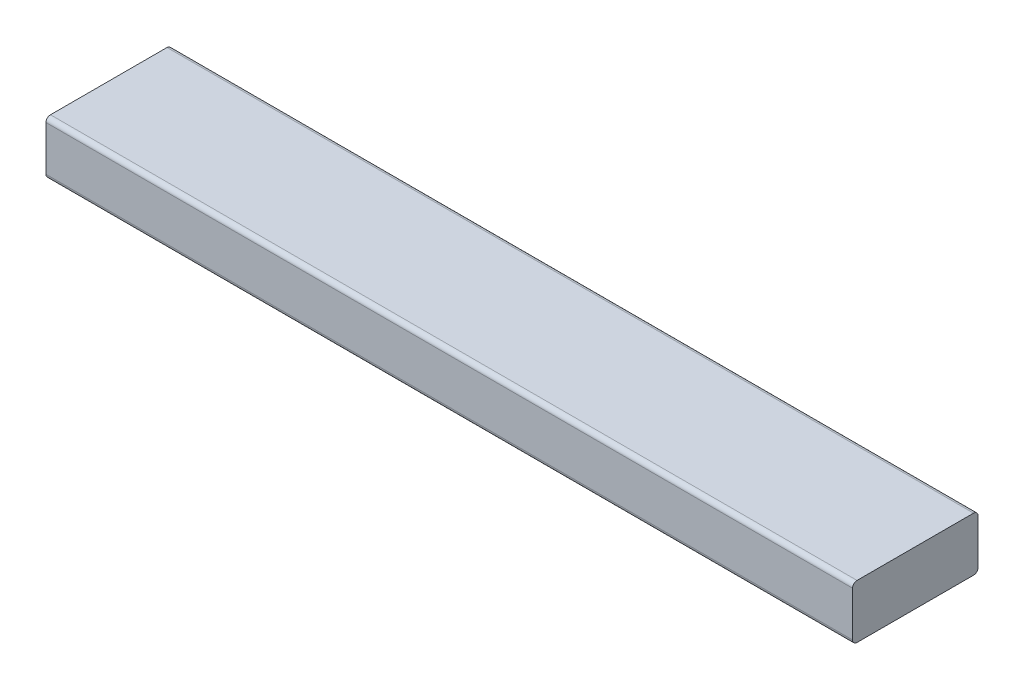
from build123d import *

# Parameters (mm, degrees)
SKETCH1_W           = 571.5
SKETCH1_H           = 38.1
BOSS_EXTRUDE1_DEPTH = 88.9
FILLET1_R           = 3.175


with BuildPart() as part:
    # Sketch1 → Boss-Extrude1 (new body)
    with BuildSketch(Plane.XY):
        with Locations((0, 19.05)):
            Rectangle(SKETCH1_W, SKETCH1_H)
    extrude(amount=BOSS_EXTRUDE1_DEPTH)

    # Fillet1
    fillet1_edges = [part.edges().sort_by_distance(p)[0] for p in [
        (0, 38.1, 88.9),
        (0, 38.1, 0),
        (0, 0, 0),
        (0, 0, 88.9),
    ]]
    fillet(fillet1_edges, radius=FILLET1_R)


solid = part.part
